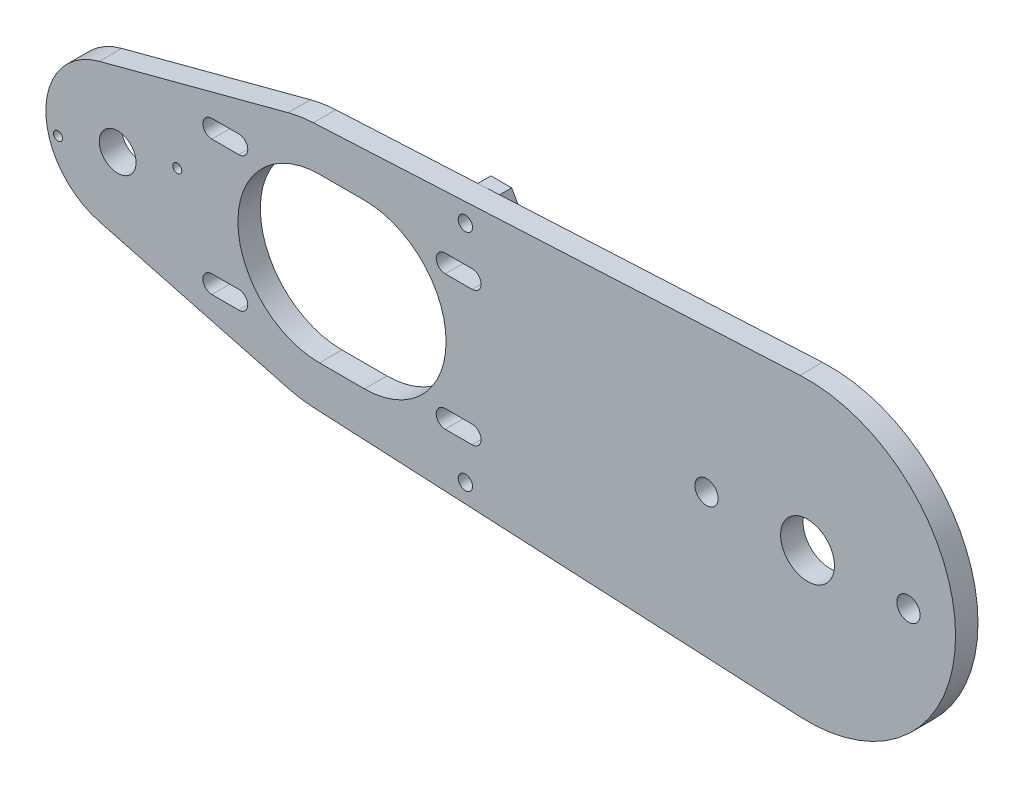
from build123d import *

# Parameters (mm, degrees)
SKETCH1_R           = 4.1
SKETCH1_R_2         = 6
BOSS_EXTRUDE1_DEPTH = 5
SKETCH7_R           = 2.6
CUT_EXTRUDE1_DEPTH  = 7
BOSS_EXTRUDE7_DEPTH = 8
SKETCH9_R           = 1.6
CUT_EXTRUDE2_DEPTH  = 7
CUT_EXTRUDE3_DEPTH  = 10
SKETCH11_R          = 1
CUT_EXTRUDE4_DEPTH  = 10


with BuildPart() as part:
    # Sketch1 → Boss-Extrude1 (new body)
    with BuildSketch(Plane.XY):
        with BuildLine():
            Line((50.206034483, 32.957769253), (-58.265804598, 27.46480771))
            ThreePointArc((-58.265804598, 27.46480771), (-61.107119662, 27.172397082), (-63.902777778, 26.586845234))
            Line((-63.902777778, 26.586845234), (-105.963888889, 15.468709954))
            ThreePointArc((-105.963888889, 15.468709954), (-117.875, 0), (-105.963888889, -15.468709954))
            Line((-105.963888889, -15.468709954), (-63.902777778, -26.586845234))
            ThreePointArc((-63.902777778, -26.586845234), (-61.107119662, -27.172397082), (-58.265804598, -27.46480771))
            Line((-58.265804598, -27.46480771), (50.206034483, -32.957769253))
            ThreePointArc((50.206034483, -32.957769253), (84.875, 0), (50.206034483, 32.957769253))
        make_face()
        with Locations((-101.875, 0)):
            Circle(SKETCH1_R, mode=Mode.SUBTRACT)
        with BuildLine():
            ThreePointArc((-46.875, 18.2), (-28.675, 0), (-46.875, -18.2))
            Line((-46.875, -18.2), (-56.875, -18.2))
            ThreePointArc((-56.875, -18.2), (-75.075, 0), (-56.875, 18.2))
            Line((-56.875, 18.2), (-46.875, 18.2))
        make_face(mode=Mode.SUBTRACT)
        with Locations((51.875, 0)):
            Circle(SKETCH1_R_2, mode=Mode.SUBTRACT)
    extrude(amount=BOSS_EXTRUDE1_DEPTH)

    # Sketch7 → Cut-Extrude1 (cut)
    with BuildSketch(Plane.XY.offset(5)):
        with Locations((29.375, 0)):
            Circle(SKETCH7_R)
        with Locations((74.375, 0)):
            Circle(SKETCH7_R)
    extrude(amount=-CUT_EXTRUDE1_DEPTH, mode=Mode.SUBTRACT)

    # Sketch8 → Boss-Extrude7 (add)
    with BuildSketch(Plane.XY.offset(5)):
        Polygon((-28.993802154, 25), (-26.684401077, 21), (-22.065598923, 21), (-19.756197846, 25), (-22.065598923, 29), (-26.684401077, 29), align=None)
        Polygon((-25.775, 27.424871131), (-27.175, 25), (-25.775, 22.575128869), (-22.975, 22.575128869), (-21.575, 25), (-22.975, 27.424871131), align=None, mode=Mode.SUBTRACT)
    boss_extrude7 = extrude(amount=-BOSS_EXTRUDE7_DEPTH)

    # Sketch9 → Cut-Extrude2 (cut)
    with BuildSketch(Plane.XY.offset(5)):
        with Locations((-24.375, 25)):
            Circle(SKETCH9_R)
    cut_extrude2 = extrude(amount=-CUT_EXTRUDE2_DEPTH, mode=Mode.SUBTRACT)

    # Mirror1: Boss-Extrude7 across plane
    add(boss_extrude7.mirror(Plane.ZX))

    # Mirror2: Cut-Extrude2 across plane
    add(cut_extrude2.mirror(Plane.ZX), mode=Mode.SUBTRACT)

    # Sketch10 → Cut-Extrude3 (cut)
    with BuildSketch(Plane.XY.offset(5)):
        with BuildLine():
            Line((-80.875, 13), (-74.875, 13))
            ThreePointArc((-74.875, 13), (-72.875, 15), (-74.875, 17))
            Line((-74.875, 17), (-80.875, 17))
            ThreePointArc((-80.875, 17), (-82.875, 15), (-80.875, 13))
        make_face()
        with BuildLine():
            ThreePointArc((-74.875, -13), (-72.875, -15), (-74.875, -17))
            Line((-74.875, -17), (-80.875, -17))
            ThreePointArc((-80.875, -17), (-82.875, -15), (-80.875, -13))
            Line((-80.875, -13), (-74.875, -13))
        make_face()
        with BuildLine():
            Line((-22.875, -13), (-28.875, -13))
            ThreePointArc((-28.875, -13), (-30.875, -15), (-28.875, -17))
            Line((-28.875, -17), (-22.875, -17))
            ThreePointArc((-22.875, -17), (-20.875, -15), (-22.875, -13))
        make_face()
        with BuildLine():
            ThreePointArc((-28.875, 13), (-30.875, 15), (-28.875, 17))
            Line((-28.875, 17), (-22.875, 17))
            ThreePointArc((-22.875, 17), (-20.875, 15), (-22.875, 13))
            Line((-22.875, 13), (-28.875, 13))
        make_face()
    extrude(amount=-CUT_EXTRUDE3_DEPTH, mode=Mode.SUBTRACT)

    # Sketch11 → Cut-Extrude4 (cut)
    with BuildSketch(Plane.XY.offset(5)):
        with Locations((-115.168208365, -3.514699328)):
            Circle(SKETCH11_R)
        with Locations((-88.581791635, 3.514699328)):
            Circle(SKETCH11_R)
    extrude(amount=-CUT_EXTRUDE4_DEPTH, mode=Mode.SUBTRACT)


solid = part.part
